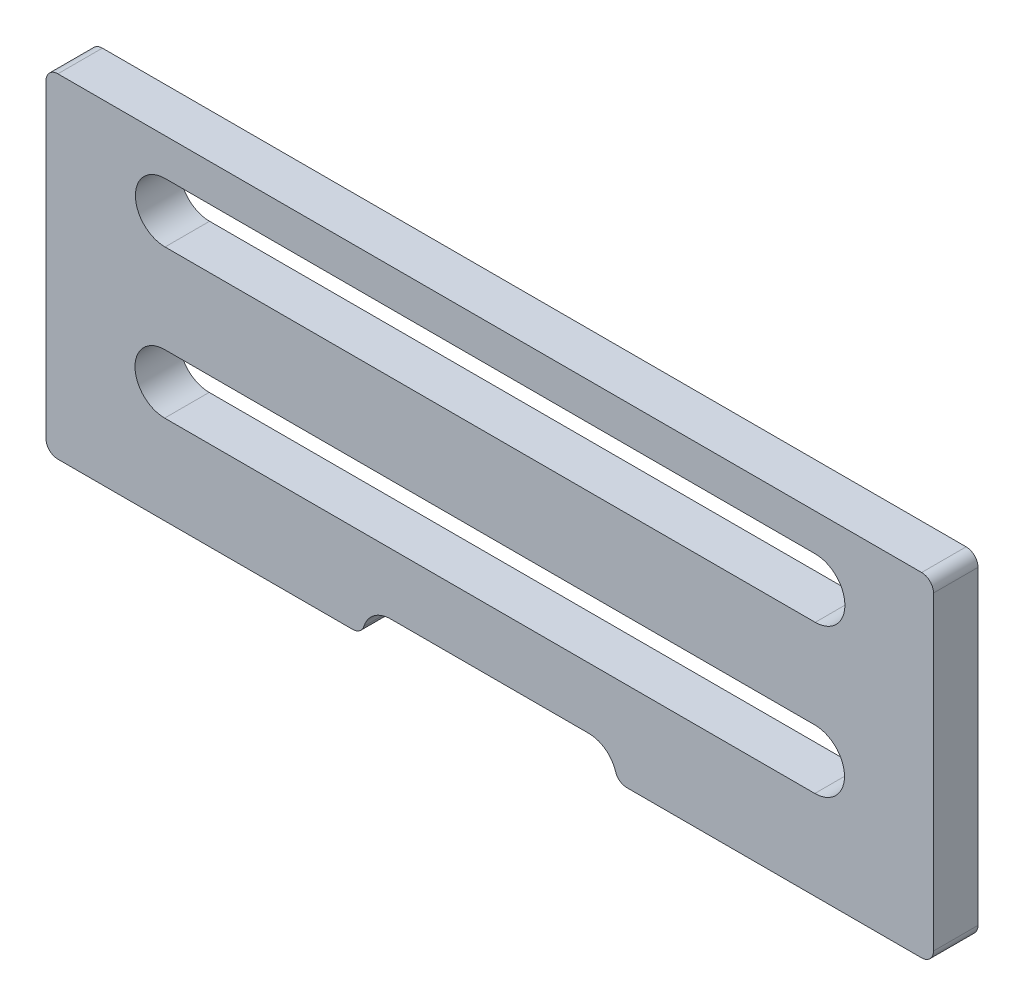
from build123d import *

# Parameters (mm, degrees)
BOSS_EXTRUDE1_DEPTH = 4.7625


with BuildPart() as part:
    # Sketch1 → Boss-Extrude1 (new body)
    with BuildSketch(Plane.XY.offset(4.7625)):
        with BuildLine():
            Line((-46.21916, -17.859375), (-14.676763422, -17.859375))
            ThreePointArc((-14.676763422, -17.859375), (-13.924040029, -17.612266731), (-13.464236596, -16.967103337))
            ThreePointArc((-13.464236596, -16.967103337), (-12.378086754, -15.44309532), (-10.6, -14.859375))
            Line((-10.6, -14.859375), (10.6, -14.859375))
            ThreePointArc((10.6, -14.859375), (12.378086754, -15.44309532), (13.464236596, -16.967103337))
            ThreePointArc((13.464236596, -16.967103337), (13.924040029, -17.612266731), (14.676763422, -17.859375))
            Line((14.676763422, -17.859375), (46.21916, -17.859375))
            ThreePointArc((46.21916, -17.859375), (47.117185612, -17.487400612), (47.48916, -16.589375))
            Line((47.48916, -16.589375), (47.48916, 16.589375))
            ThreePointArc((47.48916, 16.589375), (47.117185612, 17.487400612), (46.21916, 17.859375))
            Line((46.21916, 17.859375), (-46.21916, 17.859375))
            ThreePointArc((-46.21916, 17.859375), (-47.117185612, 17.487400612), (-47.48916, 16.589375))
            Line((-47.48916, 16.589375), (-47.48916, -16.589375))
            ThreePointArc((-47.48916, -16.589375), (-47.117185612, -17.487400612), (-46.21916, -17.859375))
        make_face()
        with BuildLine():
            Line((34.78916, -8.334375), (-34.78916, -8.334375))
            ThreePointArc((-34.78916, -8.334375), (-37.96416, -5.159375), (-34.78916, -1.984375))
            Line((-34.78916, -1.984375), (34.78916, -1.984375))
            ThreePointArc((34.78916, -1.984375), (37.96416, -5.159375), (34.78916, -8.334375))
        make_face(mode=Mode.SUBTRACT)
        with BuildLine():
            Line((34.8316655, 7.546875), (-34.7466545, 7.546875))
            ThreePointArc((-34.7466545, 7.546875), (-37.9216545, 10.721875), (-34.7466545, 13.896875))
            Line((-34.7466545, 13.896875), (34.8316655, 13.896875))
            ThreePointArc((34.8316655, 13.896875), (38.0066655, 10.721875), (34.8316655, 7.546875))
        make_face(mode=Mode.SUBTRACT)
    extrude(amount=-BOSS_EXTRUDE1_DEPTH)


solid = part.part
